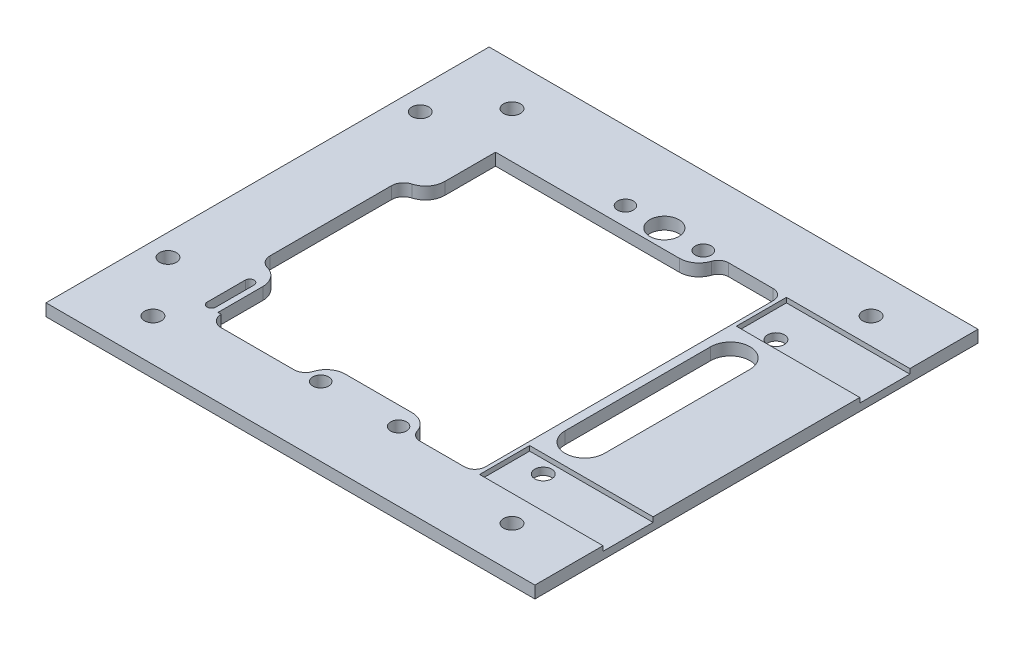
from build123d import *

# Parameters (mm, degrees)
SKETCH1_W           = 63.9826
SKETCH1_H           = 57.9882
BOSS_EXTRUDE1_DEPTH = 1.5875
SKETCH2_R           = 0.513965226
SKETCH2_R_2         = 1.1049
SKETCH2_R_3         = 1.0414
CUT_EXTRUDE1_DEPTH  = 7.62
SKETCH3_R           = 1.905
CUT_EXTRUDE2_DEPTH  = 44.204412584
SKETCH4_W           = 17.78
SKETCH4_H           = 6.5532
CUT_EXTRUDE3_DEPTH  = 0.635
SKETCH5_W           = 35.0012
SKETCH5_H           = 34.9885
CUT_EXTRUDE4_DEPTH  = 44.204412584
CUT_EXTRUDE5_DEPTH  = 44.204412584
SKETCH7_R           = 1.1049
CUT_EXTRUDE6_DEPTH  = 44.204412584
FILLET1_R           = 2.54
FILLET2_R           = 2.54
FILLET5_R           = 2.54
FILLET6_R           = 2.54
SKETCH8_R           = 1.1049
CUT_EXTRUDE7_DEPTH  = 2.54


with BuildPart() as part:
    # Sketch1 → Boss-Extrude1 (new body)
    with BuildSketch(Plane(origin=(0, 0, 0), x_dir=(1, 0, 0), z_dir=(0, 1, 0))):
        Rectangle(SKETCH1_W, SKETCH1_H)
    extrude(amount=BOSS_EXTRUDE1_DEPTH)

    # Sketch2 → Cut-Extrude1 (cut)
    with BuildSketch(Plane(origin=(0, 1.5875, 0), x_dir=(1, 0, 0), z_dir=(0, 1, 0))):
        with Locations(Location((0, 0, 0), (0, 0, 270))):
            Circle(SKETCH2_R)
        with Locations(Location((-23.495, -23.495, 0), (0, 0, 270))):
            Circle(SKETCH2_R_2)
        with Locations(Location((23.495, -23.495, 0), (0, 0, 270))):
            Circle(SKETCH2_R_2)
        with Locations(Location((-23.495, 23.495, 0), (0, 0, 270))):
            Circle(SKETCH2_R_2)
        with Locations(Location((23.495, 23.495, 0), (0, 0, 270))):
            Circle(SKETCH2_R_2)
        with Locations(Location((-5.0927, 19.939, 0), (0, 0, 270))):
            Circle(SKETCH2_R_3)
        with Locations(Location((5.0927, 19.939, 0), (0, 0, 270))):
            Circle(SKETCH2_R_3)
        with Locations(Location((5.0927, -19.939, 0), (0, 0, 270))):
            Circle(SKETCH2_R_3)
        with Locations(Location((-5.0927, -19.939, 0), (0, 0, 270))):
            Circle(SKETCH2_R_3)
    extrude(amount=-CUT_EXTRUDE1_DEPTH, mode=Mode.SUBTRACT)

    # Sketch3 → Cut-Extrude2 (cut, through all)
    with BuildSketch(Plane(origin=(0, 1.5875, 0), x_dir=(1, 0, 0), z_dir=(0, 1, 0))):
        with Locations(Location((0, 19.939, 0), (0, 0, 270))):
            Circle(SKETCH3_R)
        with BuildLine():
            Line((16.47985425, -9.525), (16.47985425, 9.525))
            ThreePointArc((16.47985425, 9.525), (19.05, 12.09514575), (21.62014575, 9.525))
            Line((21.62014575, 9.525), (21.62014575, -9.525))
            ThreePointArc((21.62014575, -9.525), (19.05, -12.09514575), (16.47985425, -9.525))
        make_face()
        with BuildLine():
            Line((-20.3835, -13.375), (-20.3835, -18.375))
            ThreePointArc((-20.3835, -18.375), (-20.955, -18.9465), (-21.5265, -18.375))
            Line((-21.5265, -18.375), (-21.5265, -13.375))
            ThreePointArc((-21.5265, -13.375), (-20.955, -12.8035), (-20.3835, -13.375))
        make_face()
    extrude(amount=-CUT_EXTRUDE2_DEPTH, mode=Mode.SUBTRACT)

    # Sketch4 → Cut-Extrude3 (cut)
    with BuildSketch(Plane(origin=(0, 1.5875, 0), x_dir=(1, 0, 0), z_dir=(0, 1, 0))):
        with Locations((24.7269, -16.8021)):
            Rectangle(SKETCH4_W, SKETCH4_H)
        with Locations((24.7269, 16.8021)):
            Rectangle(SKETCH4_W, SKETCH4_H)
    extrude(amount=-CUT_EXTRUDE3_DEPTH, mode=Mode.SUBTRACT)

    # Sketch5 → Cut-Extrude4 (cut, through all)
    with BuildSketch(Plane(origin=(0, 1.5875, 0), x_dir=(1, 0, 0), z_dir=(0, 1, 0))):
        with Locations((-2.1463, 0)):
            Rectangle(SKETCH5_W, SKETCH5_H)
    extrude(amount=-CUT_EXTRUDE4_DEPTH, mode=Mode.SUBTRACT)

    # Sketch6 → Cut-Extrude5 (cut, through all)
    with BuildSketch(Plane(origin=(0, 1.5875, 0), x_dir=(1, 0, 0), z_dir=(0, 1, 0))):
        with BuildLine():
            Line((-7.452592056, -17.49425), (-18.430007944, -17.49425))
            ThreePointArc((-18.430007944, -17.49425), (-19.013249676, -18.054409326), (-19.2278, -18.8341))
            ThreePointArc((-19.2278, -18.8341), (-18.781430735, -19.911730735), (-17.7038, -20.3581))
            Line((-17.7038, -20.3581), (-8.1788, -20.3581))
            ThreePointArc((-8.1788, -20.3581), (-6.701554692, -19.208696183), (-7.452592056, -17.49425))
        make_face()
        with BuildLine():
            Line((-18.430007944, -17.49425), (-19.6469, -17.49425))
            Line((-19.6469, -17.49425), (-19.6469, -18.8341))
            Line((-19.6469, -18.8341), (-19.2278, -18.8341))
            ThreePointArc((-19.2278, -18.8341), (-19.013249676, -18.054409326), (-18.430007944, -17.49425))
        make_face()
        with BuildLine():
            Line((-22.6568, 6.8834), (-22.6568, -8.9916))
            ThreePointArc((-22.6568, -8.9916), (-21.431305697, -10.537274003), (-19.6469, -9.696535806))
            Line((-19.6469, -9.696535806), (-19.6469, 7.588335806))
            ThreePointArc((-19.6469, 7.588335806), (-21.431305697, 8.429074003), (-22.6568, 6.8834))
        make_face()
        with BuildLine():
            Line((14.269902317, -17.49425), (7.857194183, -17.49425))
            ThreePointArc((7.857194183, -17.49425), (6.780339401, -18.977660877), (8.142735041, -20.20403854))
            Line((8.142735041, -20.20403854), (13.98436146, -20.20403854))
            ThreePointArc((13.98436146, -20.20403854), (14.953054291, -19.802792832), (15.3543, -18.8341))
            ThreePointArc((15.3543, -18.8341), (15.049233525, -17.972253674), (14.269902317, -17.49425))
        make_face()
        with BuildLine():
            Line((14.904303176, -17.49425), (14.269902317, -17.49425))
            ThreePointArc((14.269902317, -17.49425), (15.049233525, -17.972253674), (15.3543, -18.8341))
            Line((15.3543, -18.8341), (15.3543, -17.49425))
            Line((15.3543, -17.49425), (14.904303176, -17.49425))
        make_face()
        with BuildLine():
            ThreePointArc((8.142735041, 20.20403854), (6.780339401, 18.977660877), (7.857194183, 17.49425))
            Line((7.857194183, 17.49425), (14.269902317, 17.49425))
            ThreePointArc((14.269902317, 17.49425), (15.049233525, 17.972253674), (15.3543, 18.8341))
            ThreePointArc((15.3543, 18.8341), (14.953054291, 19.802792832), (13.98436146, 20.20403854))
            Line((13.98436146, 20.20403854), (8.142735041, 20.20403854))
        make_face()
        with BuildLine():
            ThreePointArc((15.3543, 18.8341), (15.049233525, 17.972253674), (14.269902317, 17.49425))
            Line((14.269902317, 17.49425), (14.904303176, 17.49425))
            Line((14.904303176, 17.49425), (15.3543, 17.49425))
            Line((15.3543, 17.49425), (15.3543, 18.8341))
        make_face()
    extrude(amount=-CUT_EXTRUDE5_DEPTH, mode=Mode.SUBTRACT)

    # Sketch7 → Cut-Extrude6 (cut, through all)
    with BuildSketch(Plane(origin=(0, 1.5875, 0), x_dir=(1, 0, 0), z_dir=(0, 1, 0))):
        with Locations(Location((-29.1465, -15.875, 0), (0, 0, 270))):
            Circle(SKETCH7_R)
        with Locations(Location((-29.1465, 17.145, 0), (0, 0, 270))):
            Circle(SKETCH7_R)
    extrude(amount=-CUT_EXTRUDE6_DEPTH, mode=Mode.SUBTRACT)

    # Fillet1
    fillet1_edges = [part.edges().sort_by_distance(p)[0] for p in [
        (-19.6469, 0.79375, -7.588335806),
        (-19.6469, 0.79375, 9.696535806),
    ]]
    fillet(fillet1_edges, radius=FILLET1_R)

    # Fillet2
    fillet2_edges = [part.edges().sort_by_distance(p)[0] for p in [
        (-7.452592056, 0.79375, 17.49425),
    ]]
    fillet(fillet2_edges, radius=FILLET2_R)

    # Fillet5
    fillet5_edges = [part.edges().sort_by_distance(p)[0] for p in [
        (7.857194183, 0.79375, 17.49425),
    ]]
    fillet(fillet5_edges, radius=FILLET5_R)

    # Fillet6
    fillet6_edges = [part.edges().sort_by_distance(p)[0] for p in [
        (7.857194183, 0.79375, -17.49425),
    ]]
    fillet(fillet6_edges, radius=FILLET6_R)

    # Sketch8 → Cut-Extrude7 (cut)
    with BuildSketch(Plane(origin=(0, 0.9525, 0), x_dir=(1, 0, 0), z_dir=(0, 1, 0))):
        with Locations(Location((19.3167, 15.2273, 0), (0, 0, 270))):
            Circle(SKETCH8_R)
        with Locations(Location((19.3167, -15.2273, 0), (0, 0, 270))):
            Circle(SKETCH8_R)
    extrude(amount=-CUT_EXTRUDE7_DEPTH, mode=Mode.SUBTRACT)


solid = part.part
